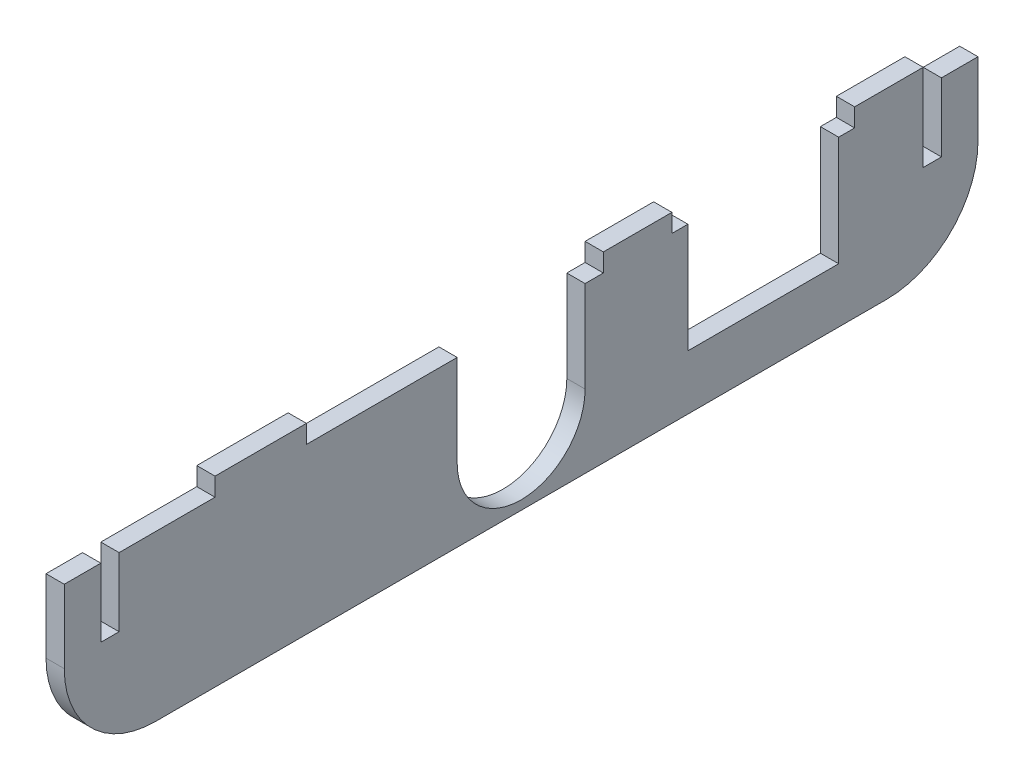
from build123d import *

# Parameters (mm, degrees)
SKETCH1_W           = 254
SKETCH1_H           = 45.72
BOSS_EXTRUDE1_DEPTH = 5.08
SKETCH2_R           = 17.78
CUT_EXTRUDE2_DEPTH  = 259.131991043
CUT_EXTRUDE3_DEPTH  = 259.131991043
FILLET1_R           = 25.4
SKETCH5_W           = 5.08
SKETCH5_H           = 25.4
BOSS_EXTRUDE2_DEPTH = 5.08
SKETCH7_W           = 5.08
SKETCH7_H           = 19.05
CUT_EXTRUDE4_DEPTH  = 31.75
SKETCH9_W           = 5.08
SKETCH9_H           = 19.05
BOSS_EXTRUDE3_DEPTH = 5.08
SKETCH10_W          = 41.91
SKETCH10_H          = 30.48
CUT_EXTRUDE6_DEPTH  = 260.08


with BuildPart() as part:
    # Sketch1 → Boss-Extrude1 (new body)
    with BuildSketch(Plane(origin=(0, 0, 0), x_dir=(0, 0, -1), z_dir=(1, 0, 0))):
        with Locations((127, 22.86)):
            Rectangle(SKETCH1_W, SKETCH1_H)
    extrude(amount=BOSS_EXTRUDE1_DEPTH)

    # Sketch2 → Cut-Extrude2 (cut, through all)
    with BuildSketch(Plane(origin=(5.08, 0, 0), x_dir=(0, 0, -1), z_dir=(1, 0, 0))):
        with Locations((127, 20.32)):
            Circle(SKETCH2_R)
    extrude(amount=-CUT_EXTRUDE2_DEPTH, mode=Mode.SUBTRACT)

    # Sketch4 → Cut-Extrude3 (cut, through all)
    with BuildSketch(Plane(origin=(5.08, 0, 0), x_dir=(0, 0, -1), z_dir=(1, 0, 0))):
        Polygon((109.22, 20.32), (109.22, 45.72), (127, 45.72), (144.78, 45.72), (144.78, 20.32), align=None)
    extrude(amount=-CUT_EXTRUDE3_DEPTH, mode=Mode.SUBTRACT)

    # Fillet1
    fillet1_edges = [part.edges().sort_by_distance(p)[0] for p in [
        (2.54, 0, -254),
        (2.54, 0, 0),
    ]]
    fillet(fillet1_edges, radius=FILLET1_R)

    # Sketch5 → Boss-Extrude2 (add)
    with BuildSketch(Plane(origin=(0, 45.72, 0), x_dir=(1, 0, 0), z_dir=(0, 1, 0))):
        with Locations((2.54, 54.61)):
            Rectangle(SKETCH5_W, SKETCH5_H)
    extrude(amount=BOSS_EXTRUDE2_DEPTH)

    # Sketch7 → Cut-Extrude4 (cut)
    with BuildSketch(Plane(origin=(5.08, 0, 0), x_dir=(0, 0, -1), z_dir=(1, 0, 0))):
        with Locations((12.7, 36.195)):
            Rectangle(SKETCH7_W, SKETCH7_H)
    cut_extrude4 = extrude(amount=-CUT_EXTRUDE4_DEPTH, mode=Mode.SUBTRACT)

    # Mirror1: Cut-Extrude4 across plane
    add(cut_extrude4.mirror(Plane.XY.offset(-127)), mode=Mode.SUBTRACT)

    # Sketch9 → Boss-Extrude3 (add)
    with BuildSketch(Plane(origin=(0, 45.72, 0), x_dir=(1, 0, 0), z_dir=(0, 1, 0))):
        with Locations((2.54, 229.235)):
            Rectangle(SKETCH9_W, SKETCH9_H)
        with Locations((2.54, 159.385)):
            Rectangle(SKETCH9_W, SKETCH9_H)
    extrude(amount=BOSS_EXTRUDE3_DEPTH)

    # Sketch10 → Cut-Extrude6 (cut, through all)
    with BuildSketch(Plane(origin=(5.08, 0, 0), x_dir=(0, 0, -1), z_dir=(1, 0, 0))):
        with Locations((194.31, 30.48)):
            Rectangle(SKETCH10_W, SKETCH10_H)
    extrude(amount=-CUT_EXTRUDE6_DEPTH, mode=Mode.SUBTRACT)


solid = part.part
